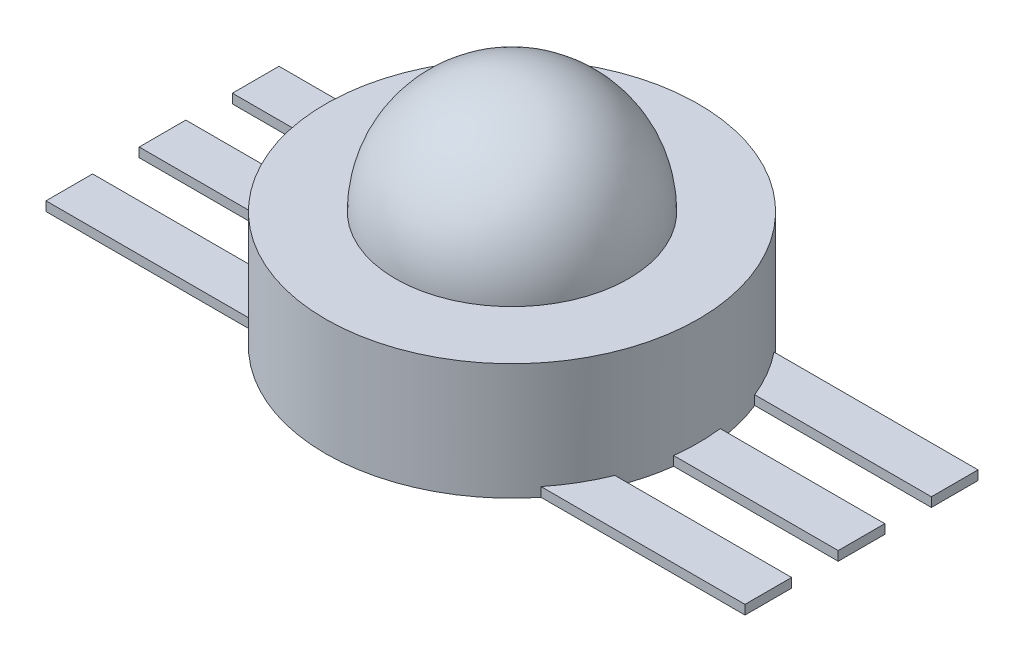
from build123d import *

# Parameters (mm, degrees)
SKETCH_1_R      = 4
EXTRUDE_1_DEPTH = 2.5
SKETCH_3_W      = 15
SKETCH_3_H      = 1
EXTRUDE_2_DEPTH = 0.2


with BuildPart() as part:
    # Эскиз1 → Бобышка-Вытянуть1 (new body)
    with BuildSketch(Plane(origin=(0, 0, 0), x_dir=(1, 0, 0), z_dir=(0, 1, 0))):
        with Locations(Location((0, 0, 0), (0, 0, 270))):
            Circle(SKETCH_1_R)
    extrude(amount=EXTRUDE_1_DEPTH)

    # Эскиз2 → Повернуть1 (revolve)
    with BuildSketch(Plane.XY):
        with BuildLine():
            Line((-2.5, 2.5), (0, 2.5))
            Line((0, 2.5), (0, 5))
            ThreePointArc((0, 5), (-1.767766953, 4.267766953), (-2.5, 2.5))
        make_face()
    revolve(axis=Axis((0, 0, 0), (0, 1, 0)))

    # Эскиз3 → Бобышка-Вытянуть2 (add)
    with BuildSketch(Plane(origin=(0, 0, 0), x_dir=(1, 0, 0), z_dir=(0, 1, 0))):
        with Locations((0, 2)):
            Rectangle(SKETCH_3_W, SKETCH_3_H)
        Rectangle(SKETCH_3_W, SKETCH_3_H)
        with Locations((0, -2)):
            Rectangle(SKETCH_3_W, SKETCH_3_H)
    extrude(amount=EXTRUDE_2_DEPTH)


solid = part.part
